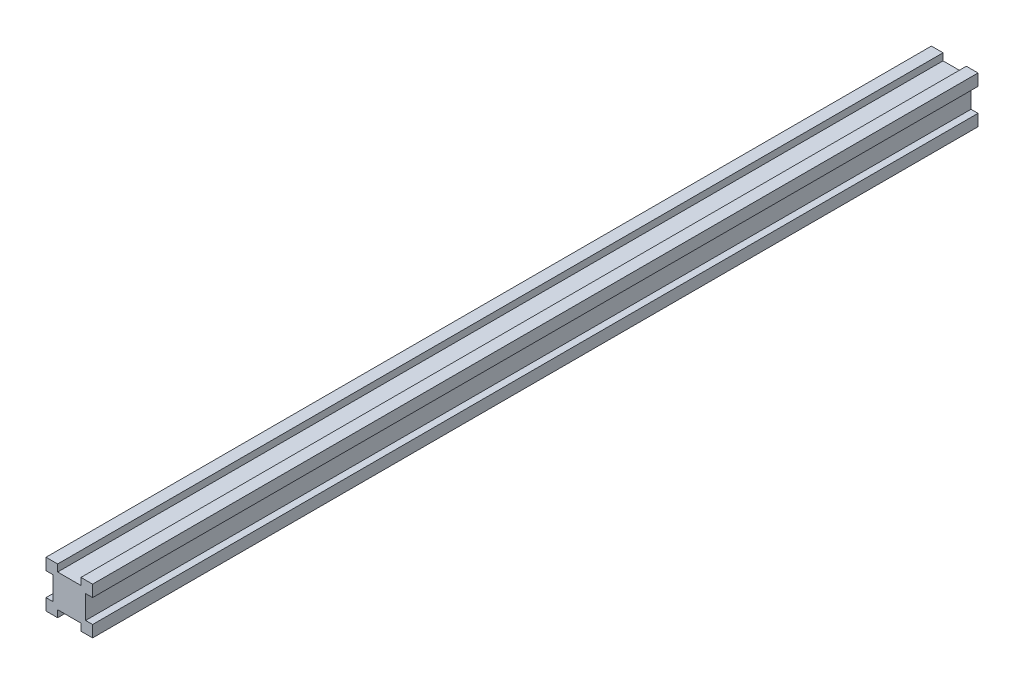
from build123d import *

# Parameters (mm, degrees)
EXTRUDE_1_DEPTH = 190


with BuildPart() as part:
    # 草图1 → 凸台-拉伸1 (new, symmetric)
    with BuildSketch(Plane.XY):
        Polygon((-5, 7), (-5, 10), (-10, 10), (-10, 5), (-7, 5), (-7, -5), (-10, -5), (-10, -10), (-5, -10), (-5, -7), (5, -7), (5, -10), (10, -10), (10, -5), (7, -5), (7, 5), (10, 5), (10, 10), (5, 10), (5, 7), align=None)
    extrude(amount=EXTRUDE_1_DEPTH, both=True)


solid = part.part
